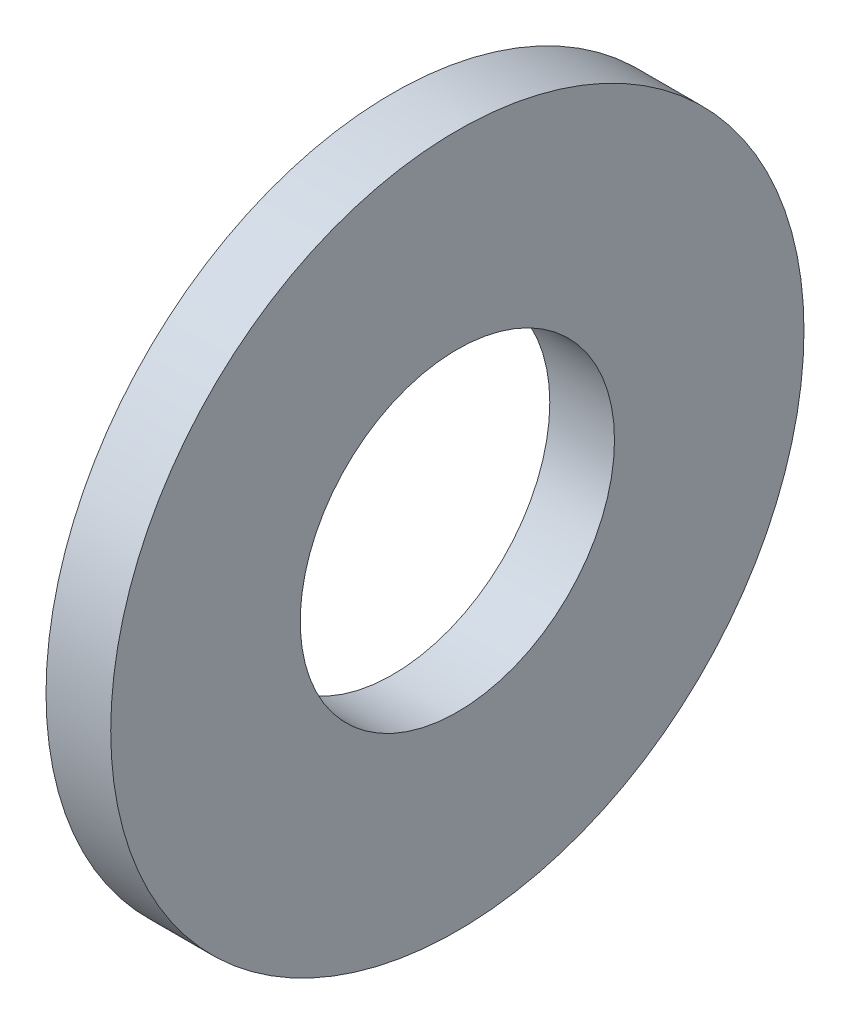
from build123d import *

# Parameters (mm, degrees)
SKETCH1_R           = 4.7625
SKETCH1_R_2         = 2.159
BOSS_EXTRUDE1_DEPTH = 0.889


with BuildPart() as part:
    # Sketch1 → Boss-Extrude1 (new body)
    with BuildSketch(Plane(origin=(0, 0, 0), x_dir=(0, 0, -1), z_dir=(1, 0, 0))):
        Circle(SKETCH1_R)
        Circle(SKETCH1_R_2, mode=Mode.SUBTRACT)
    extrude(amount=BOSS_EXTRUDE1_DEPTH)


solid = part.part
